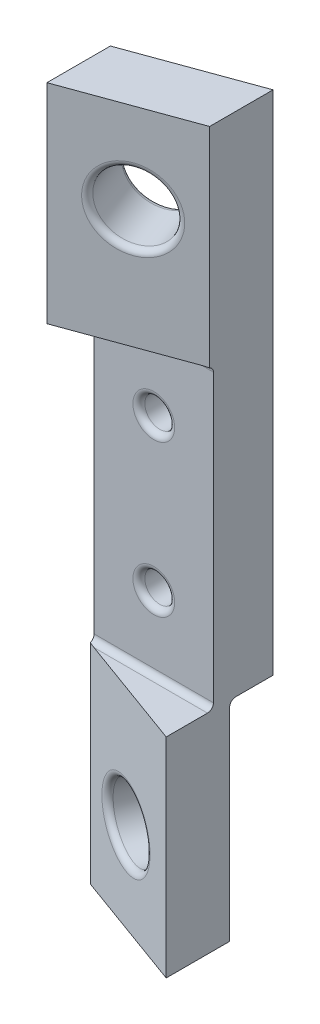
from build123d import *

# Parameters (mm, degrees)
SKETCH1_W           = 50
SKETCH1_H           = 20
SKETCH1_R           = 2.5
BOSS_EXTRUDE1_DEPTH = 10
BOSS_EXTRUDE2_DEPTH = 35
SKETCH4_R           = 5.75
CUT_EXTRUDE1_DEPTH  = 35
BOSS_EXTRUDE3_DEPTH = 35
SKETCH6_R           = 5.75
CUT_EXTRUDE2_DEPTH  = 35
FILLET1_R           = 1
FILLET2_R           = 1
FILLET3_R           = 1
FILLET4_R           = 1
FILLET5_R           = 1
FILLET6_R           = 1
FILLET7_R           = 1
FILLET8_R           = 1
FILLET9_R           = 1
FILLET10_R          = 1
FILLET11_R          = 1
FILLET12_R          = 1


with BuildPart() as part:
    # Sketch1 → Boss-Extrude1 (new body)
    with BuildSketch(Plane(origin=(0, 0, 0), x_dir=(0, 1, 0), z_dir=(0, 0, 1))):
        Rectangle(SKETCH1_W, SKETCH1_H)
        with Locations(Location((-12.7, 0, 0), (0, 0, 270))):
            Circle(SKETCH1_R, mode=Mode.SUBTRACT)
        with Locations(Location((12.7, 0, 0), (0, 0, 270))):
            Circle(SKETCH1_R, mode=Mode.SUBTRACT)
    extrude(amount=BOSS_EXTRUDE1_DEPTH)

    # Sketch3 → Boss-Extrude2 (add)
    with BuildSketch(Plane.XZ.offset(25)):
        Polygon((10, 7.279404685), (10, 17.92118241), (-10, 10.641777725), (-10, 0), align=None)
    extrude(amount=BOSS_EXTRUDE2_DEPTH)

    # Sketch4 → Cut-Extrude1 (cut)
    with BuildSketch(Plane(origin=(-4.589979218, 0, 12.610864256), x_dir=(0.9396926207859081, 0, 0.3420201433256699), z_dir=(-0.3420201433256699, 0, 0.9396926207859081))):
        with Locations((4.242776135, -45)):
            Circle(SKETCH4_R)
    extrude(amount=-CUT_EXTRUDE1_DEPTH, mode=Mode.SUBTRACT)

    # Sketch5 → Boss-Extrude3 (add)
    with BuildSketch(Plane(origin=(0, 25, 0), x_dir=(-1, 0, 0), z_dir=(0, 1, 0))):
        Polygon((-10, 0), (10, 7.279404685), (10, 17.92118241), (-10, 10.641777725), align=None)
    extrude(amount=BOSS_EXTRUDE3_DEPTH)

    # Sketch6 → Cut-Extrude2 (cut)
    with BuildSketch(Plane(origin=(4.589979218, 0, 12.610864256), x_dir=(0.9396926207859081, 0, -0.3420201433256698), z_dir=(0.3420201433256698, 0, 0.9396926207859081))):
        with Locations((-4.242776135, 45)):
            Circle(SKETCH6_R)
    extrude(amount=-CUT_EXTRUDE2_DEPTH, mode=Mode.SUBTRACT)

    # Fillet1
    fillet1_edges = [part.edges().sort_by_distance(p)[0] for p in [
        (-2.5, 12.7, 0),
    ]]
    fillet(fillet1_edges, radius=FILLET1_R)

    # Fillet2
    fillet2_edges = [part.edges().sort_by_distance(p)[0] for p in [
        (0, 25, 10),
    ]]
    fillet(fillet2_edges, radius=FILLET2_R)

    # Fillet3
    fillet3_edges = [part.edges().sort_by_distance(p)[0] for p in [
        (0, -25, 3.639702343),
    ]]
    fillet(fillet3_edges, radius=FILLET3_R)

    # Fillet4
    fillet4_edges = [part.edges().sort_by_distance(p)[0] for p in [
        (0, -25, 10),
    ]]
    fillet(fillet4_edges, radius=FILLET4_R)

    # Fillet5
    fillet5_edges = [part.edges().sort_by_distance(p)[0] for p in [
        (0, 25, 3.639702343),
    ]]
    fillet(fillet5_edges, radius=FILLET5_R)

    # Fillet6
    fillet6_edges = [part.edges().sort_by_distance(p)[0] for p in [
        (-8.220360211, 45, 6.631668774),
    ]]
    fillet(fillet6_edges, radius=FILLET6_R)

    # Fillet7
    fillet7_edges = [part.edges().sort_by_distance(p)[0] for p in [
        (-4.800158777, 45, 16.028594982),
    ]]
    fillet(fillet7_edges, radius=FILLET7_R)

    # Fillet8
    fillet8_edges = [part.edges().sort_by_distance(p)[0] for p in [
        (-2.586104928, -45, 2.698437126),
    ]]
    fillet(fillet8_edges, radius=FILLET8_R)

    # Fillet9
    fillet9_edges = [part.edges().sort_by_distance(p)[0] for p in [
        (-6.006306362, -45, 12.095363334),
    ]]
    fillet(fillet9_edges, radius=FILLET9_R)

    # Fillet10
    fillet10_edges = [part.edges().sort_by_distance(p)[0] for p in [
        (-2.5, -12.7, 0),
    ]]
    fillet(fillet10_edges, radius=FILLET10_R)

    # Fillet11
    fillet11_edges = [part.edges().sort_by_distance(p)[0] for p in [
        (-2.5, 12.7, 10),
    ]]
    fillet(fillet11_edges, radius=FILLET11_R)

    # Fillet12
    fillet12_edges = [part.edges().sort_by_distance(p)[0] for p in [
        (-2.5, -12.7, 10),
    ]]
    fillet(fillet12_edges, radius=FILLET12_R)


solid = part.part
